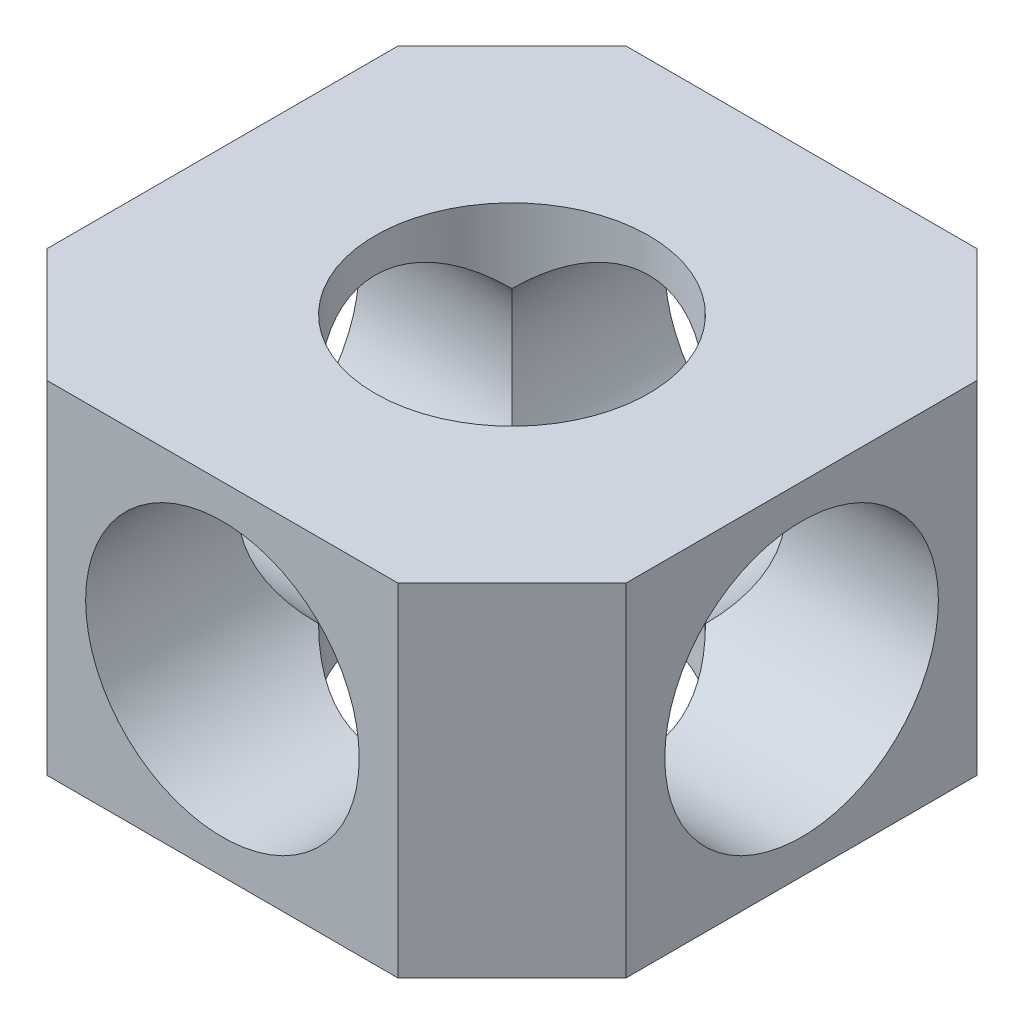
from build123d import *

# Parameters (mm, degrees)
SKETCH1_W           = 25.4
SKETCH1_H           = 25.4
BOSS_EXTRUDE1_DEPTH = 7.5
CHAMFER1_SIZE       = 5
HOLE1_D             = 12
HOLE1_DEPTH         = 100
HOLE2_D             = 12
HOLE2_DEPTH         = 100
HOLE3_D             = 12
HOLE3_DEPTH         = 100


with BuildPart() as part:
    # Sketch1 → Boss-Extrude1 (new, symmetric)
    with BuildSketch(Plane(origin=(0, 0, 0), x_dir=(1, 0, 0), z_dir=(0, 1, 0))):
        Rectangle(SKETCH1_W, SKETCH1_H)
    extrude(amount=BOSS_EXTRUDE1_DEPTH, both=True)

    # Chamfer1
    chamfer1_edges = [part.edges().sort_by_distance(p)[0] for p in [
        (12.7, 0, 12.7),
        (-12.7, 0, 12.7),
        (-12.7, 0, -12.7),
        (12.7, 0, -12.7),
    ]]
    chamfer(chamfer1_edges, length=CHAMFER1_SIZE)

    # Hole1
    with Locations(Plane(origin=(0, 7.5, 0), x_dir=(1, 0, 0), z_dir=(0, 1, 0))):
        with Locations((0, 0)):
            Hole(HOLE1_D / 2, depth=HOLE1_DEPTH)

    # Hole2
    with Locations(Plane.ZY.offset(12.7)):
        with Locations((0, 0)):
            Hole(HOLE2_D / 2, depth=HOLE2_DEPTH)

    # Hole3
    with Locations(Plane.XY.offset(12.7)):
        with Locations((0, 0)):
            Hole(HOLE3_D / 2, depth=HOLE3_DEPTH)


solid = part.part
